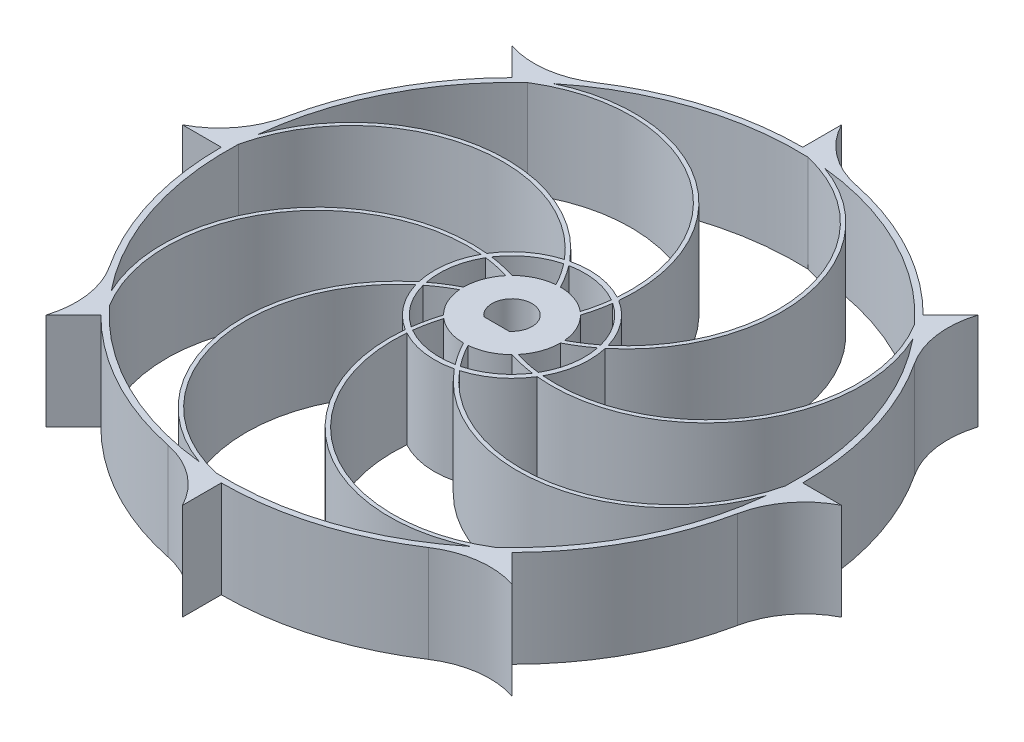
from build123d import *

# Parameters (mm, degrees)
SKETCH1_R             = 60
SKETCH1_R_2           = 58.8
BOSS_EXTRUDE1_DEPTH   = 20
SKETCH1_R_3           = 10
BOSS_EXTRUDE1_2_DEPTH = 20
BOSS_EXTRUDE4_DEPTH   = 20
CIRPATTERN1_COUNT     = 8
SKETCH2_R             = 16
SKETCH2_R_2           = 15
BOSS_EXTRUDE2_DEPTH   = 20
BOSS_EXTRUDE3_DEPTH   = 20


with BuildPart() as part:
    # Sketch1 → Boss-Extrude1 (new body)
    with BuildSketch(Plane(origin=(0, 0, 0), x_dir=(1, 0, 0), z_dir=(0, 1, 0))):
        with Locations(Location((0, 0, 0), (0, 0, 270))):
            Circle(SKETCH1_R)
        with Locations(Location((0, 0, 0), (0, 0, 270))):
            Circle(SKETCH1_R_2, mode=Mode.SUBTRACT)
    extrude(amount=BOSS_EXTRUDE1_DEPTH)



with BuildPart() as body_2:
    # Sketch1 → Boss-Extrude1 2 (new body)
    with BuildSketch(Plane(origin=(0, 0, 0), x_dir=(1, 0, 0), z_dir=(0, 1, 0))):
        with Locations(Location((0, 0, 0), (0, 0, 270))):
            Circle(SKETCH1_R_3)
        with BuildLine():
            ThreePointArc((2.603003073, -3.2), (0, 4.125), (-2.603003073, -3.2))
            Line((-2.603003073, -3.2), (2.603003073, -3.2))
        make_face(mode=Mode.SUBTRACT)
    extrude(amount=BOSS_EXTRUDE1_2_DEPTH)


with BuildPart() as part_1:
    add(part.part)

    add(body_2.part)  # Boss-Extrude4 merges body 2
    # Sketch4 → Boss-Extrude4 (add)
    with BuildSketch(Plane(origin=(0, 0, 0), x_dir=(1, 0, 0), z_dir=(0, 1, 0))):
        with BuildLine():
            Line((-9.632475442, -0.71058124), (-10, 0))
            ThreePointArc((-10, 0), (-26.841730813, -33.640288469), (0, -60))
            Line((0, -60), (0.117199585, -59.208631402))
            ThreePointArc((0.117199585, -59.208631402), (-26.052615674, -33.508769279), (-9.632475442, -0.71058124))
        make_face()
    boss_extrude4 = extrude(amount=BOSS_EXTRUDE4_DEPTH)

    # CirPattern1: Boss-Extrude4 ×8 about axis
    cirpattern1_axis = Axis((0, 0, 0), (0, 1, 0))
    for i in range(1, CIRPATTERN1_COUNT):
        add(boss_extrude4.rotate(cirpattern1_axis, i * 360 / CIRPATTERN1_COUNT))

    # Sketch2 → Boss-Extrude2 (add)
    with BuildSketch(Plane(origin=(0, 0, 0), x_dir=(1, 0, 0), z_dir=(0, 1, 0))):
        Circle(SKETCH2_R)
        Circle(SKETCH2_R_2, mode=Mode.SUBTRACT)
    extrude(amount=BOSS_EXTRUDE2_DEPTH)

    # Sketch3 → Boss-Extrude3 (add)
    with BuildSketch(Plane(origin=(0, 0, 0), x_dir=(1, 0, 0), z_dir=(0, 1, 0))):
        with BuildLine():
            Line((0, -68), (0, -60))
            ThreePointArc((0, -60), (-6.139084092, -59.685104059), (-12.213729096, -58.74372155))
            ThreePointArc((-12.213729096, -58.74372155), (-5.063374474, -61.994967767), (0, -68))
        make_face()
        with BuildLine():
            ThreePointArc((42.426406871, -42.426406871), (37.862753824, -46.544729808), (32.901673193, -50.174494528))
            ThreePointArc((32.901673193, -50.174494527), (40.256715681, -47.417408534), (48.083261121, -48.08326112))
            Line((48.083261121, -48.08326112), (42.426406871, -42.426406871))
        make_face()
        with BuildLine():
            Line((-48.083261121, -48.083261121), (-42.426406872, -42.426406871))
            ThreePointArc((-42.426406871, -42.426406871), (-46.544729808, -37.862753824), (-50.174494528, -32.901673193))
            ThreePointArc((-50.174494528, -32.901673193), (-47.417408535, -40.256715682), (-48.083261121, -48.083261121))
        make_face()
        with BuildLine():
            ThreePointArc((60, 0), (59.685104059, -6.139084092), (58.74372155, -12.213729095))
            ThreePointArc((58.74372155, -12.213729095), (61.994967767, -5.063374474), (68, 1e-09))
            Line((68, 1e-09), (60, 1e-09))
        make_face()
        with BuildLine():
            Line((-68.000000001, 0), (-60.000000001, 0))
            ThreePointArc((-60, 0), (-59.685104059, 6.139084092), (-58.74372155, 12.213729096))
            ThreePointArc((-58.743721551, 12.213729096), (-61.994967768, 5.063374474), (-68.000000001, 0))
        make_face()
        with BuildLine():
            ThreePointArc((42.42640687, 42.426406872), (46.544729807, 37.862753825), (50.174494527, 32.901673194))
            ThreePointArc((50.174494527, 32.901673194), (47.417408534, 40.256715682), (48.08326112, 48.083261122))
            Line((48.08326112, 48.083261122), (42.42640687, 42.426406872))
        make_face()
        with BuildLine():
            Line((-48.083261122, 48.083261121), (-42.426406872, 42.426406871))
            ThreePointArc((-42.426406872, 42.426406871), (-37.862753824, 46.544729807), (-32.901673194, 50.174494527))
            ThreePointArc((-32.901673194, 50.174494528), (-40.256715682, 47.417408534), (-48.083261122, 48.083261121))
        make_face()
        with BuildLine():
            ThreePointArc((-1e-09, 60), (6.139084091, 59.685104059), (12.213729095, 58.74372155))
            ThreePointArc((12.213729095, 58.743721551), (5.063374473, 61.994967768), (-1e-09, 68.000000001))
            Line((-1e-09, 68.000000001), (-1e-09, 60.000000001))
        make_face()
    extrude(amount=BOSS_EXTRUDE3_DEPTH)


solid = part_1.part
